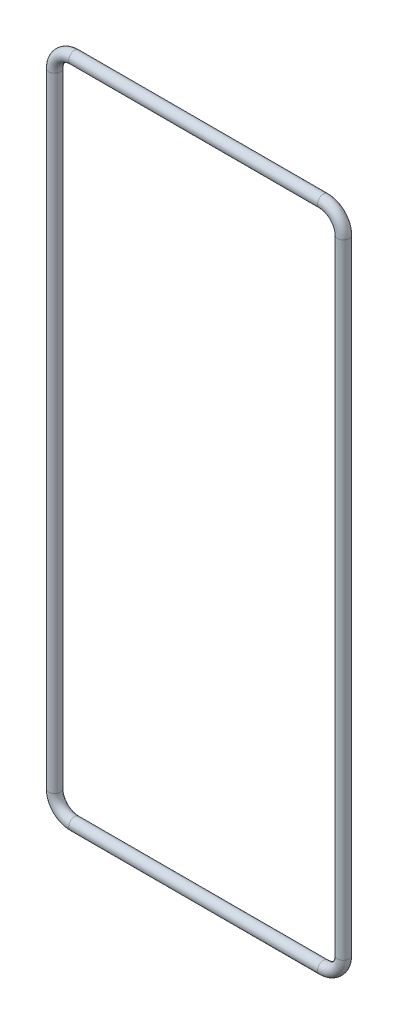
from build123d import *

# Parameters (mm, degrees)
ESBO_O2_R = 1.765


with BuildPart() as part:
    # Varredura1: sweep along a path in Esboço1
    with BuildLine(Plane.XY) as varredura1_path:
        Line((-37.5, -100), (37.5, -100))
        ThreePointArc((37.5, -100), (41.742640687, -98.242640687), (43.5, -94))
        Line((43.5, -94), (43.5, 94))
        ThreePointArc((43.5, 94), (41.742640687, 98.242640687), (37.5, 100))
        Line((37.5, 100), (-37.5, 100))
        ThreePointArc((-37.5, 100), (-41.742640687, 98.242640687), (-43.5, 94))
        Line((-43.5, 94), (-43.5, -94))
        ThreePointArc((-43.5, -94), (-41.742640687, -98.242640687), (-37.5, -100))
    # Esboço2 → Varredura1 (sweep)
    with BuildSketch(Plane(origin=(0, 0, 0), x_dir=(1, 0, 0), z_dir=(0, 1, 0))):
        with Locations((43.5, 0)):
            Circle(ESBO_O2_R)
    sweep(path=varredura1_path.line)


solid = part.part
